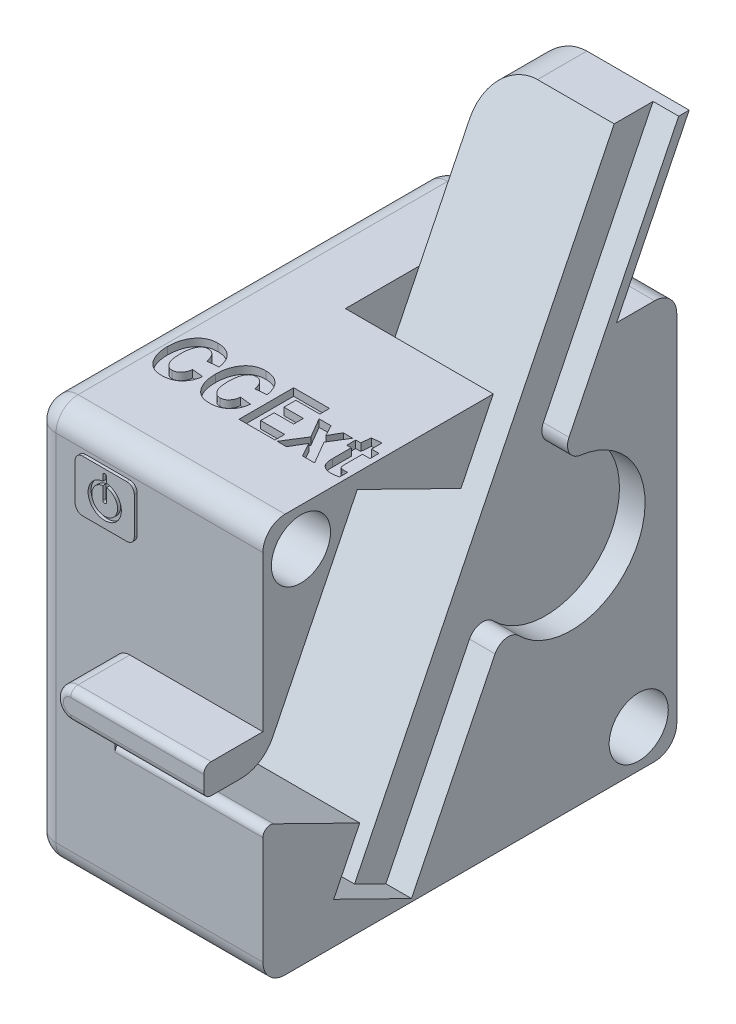
from build123d import *

# Parameters (mm, degrees)
SKETCH1_W           = 393.7
SKETCH1_H           = 342.9
BOSS_EXTRUDE1_DEPTH = 355.6
SKETCH2_W           = 50.8
SKETCH2_H           = 44.45
BOSS_EXTRUDE2_DEPTH = 2.54
BOSS_EXTRUDE3_DEPTH = 2.54
SKETCH4_R           = 3.81
CUT_EXTRUDE1_DEPTH  = 2.54
BOSS_EXTRUDE4_DEPTH = 50.8
FILLET1_R           = 6.35
FILLET2_R           = 6.35
SKETCH6_R           = 14.2875
SKETCH6_R_2         = 11.1125
CUT_EXTRUDE2_DEPTH  = 2.54
FILLET3_R           = 19.05
BOSS_EXTRUDE5_DEPTH = 127
FILLET4_R           = 39.116
SKETCH8_W           = 254
SKETCH8_H           = 63.5
CUT_EXTRUDE3_DEPTH  = 25.4
CUT_EXTRUDE4_DEPTH  = 652.703070808
CUT_EXTRUDE5_DEPTH  = 127
BOSS_EXTRUDE6_DEPTH = 127
SKETCH12_W          = 22
SKETCH12_H          = 524.644243645
CUT_EXTRUDE6_DEPTH  = 30
SKETCH13_R          = 63.5
CUT_EXTRUDE7_DEPTH  = 22
FILLET5_R           = 12.7
CUT_EXTRUDE8_REACH  = 653.703
FILLET7_R           = 6.35
SKETCH15_R          = 25.4
CUT_EXTRUDE9_DEPTH  = 53.34
CUT_EXTRUDE10_DEPTH = 6.35


with BuildPart() as part:
    # Sketch1 → Boss-Extrude1 (new body)
    with BuildSketch(Plane.XY):
        with Locations((0, 171.45)):
            Rectangle(SKETCH1_W, SKETCH1_H)
    extrude(amount=BOSS_EXTRUDE1_DEPTH)

    # Sketch2 → Boss-Extrude2 (add)
    with BuildSketch(Plane.XY.offset(355.6)):
        with Locations((-133.35, 298.45)):
            Rectangle(SKETCH2_W, SKETCH2_H)
    extrude(amount=BOSS_EXTRUDE2_DEPTH)

    # Sketch3 → Boss-Extrude3 (add)
    with BuildSketch(Plane.XY.offset(355.6)):
        with BuildLine():
            Line((88.9, 307.975), (165.1, 307.975))
            ThreePointArc((165.1, 307.975), (174.625, 298.45), (165.1, 288.925))
            Line((165.1, 288.925), (88.9, 288.925))
            ThreePointArc((88.9, 288.925), (79.375, 298.45), (88.9, 307.975))
        make_face()
    extrude(amount=BOSS_EXTRUDE3_DEPTH)

    # Sketch4 → Cut-Extrude1 (cut)
    with BuildSketch(Plane.XY.offset(358.14)):
        with Locations((92.075, 298.45)):
            Circle(SKETCH4_R)
        with Locations((108.286467636, 298.45)):
            Circle(SKETCH4_R)
        with Locations((124.497935272, 298.45)):
            Circle(SKETCH4_R)
    extrude(amount=-CUT_EXTRUDE1_DEPTH, mode=Mode.SUBTRACT)

    # Sketch5 → Boss-Extrude4 (add)
    with BuildSketch(Plane.XY.offset(355.6)):
        with BuildLine():
            Line((-114.3, 190.5), (114.3, 190.5))
            ThreePointArc((114.3, 190.5), (127, 177.8), (114.3, 165.1))
            Line((114.3, 165.1), (-114.3, 165.1))
            ThreePointArc((-114.3, 165.1), (-127, 177.8), (-114.3, 190.5))
        make_face()
    extrude(amount=BOSS_EXTRUDE4_DEPTH)

    # Fillet1
    fillet1_edges = [part.edges().sort_by_distance(p)[0] for p in [
        (-127, 177.8, 406.4),
        (0, 165.1, 406.4),
        (127, 177.8, 406.4),
        (0, 190.5, 406.4),
    ]]
    fillet(fillet1_edges, radius=FILLET1_R)

    # Fillet2
    fillet2_edges = [part.edges().sort_by_distance(p)[0] for p in [
        (-107.95, 276.225, 356.87),
        (-107.95, 320.675, 356.87),
        (-158.75, 320.675, 356.87),
        (-158.75, 276.225, 356.87),
    ]]
    fillet(fillet2_edges, radius=FILLET2_R)

    # Sketch6 → Cut-Extrude2 (cut)
    # profile 1 of 2: a face of its own
    with BuildSketch(Plane.XY.offset(358.14)):
        with Locations((-133.35, 296.545)):
            Circle(SKETCH6_R)
        with Locations((-133.35, 296.545)):
            Circle(SKETCH6_R_2, mode=Mode.SUBTRACT)
    # profile 2 of 2: a face of its own
    with BuildSketch(Plane.XY.offset(358.14)):
        with BuildLine():
            Line((-134.9375, 296.545), (-134.9375, 315.595))
            ThreePointArc((-134.9375, 315.595), (-133.35, 317.1825), (-131.7625, 315.595))
            Line((-131.7625, 315.595), (-131.7625, 296.545))
            ThreePointArc((-131.7625, 296.545), (-133.35, 294.9575), (-134.9375, 296.545))
        make_face()
    extrude(amount=-CUT_EXTRUDE2_DEPTH, mode=Mode.SUBTRACT)

    # Fillet3
    fillet3_edges = [part.edges().sort_by_distance(p)[0] for p in [
        (196.85, 171.45, 355.6),
        (0, 342.9, 355.6),
        (-196.85, 171.45, 355.6),
        (0, 342.9, 0),
        (196.85, 171.45, 0),
        (0, 0, 0),
        (-196.85, 171.45, 0),
        (0, 0, 355.6),
        (-196.85, 342.9, 177.8),
        (196.85, 342.9, 177.8),
        (196.85, 0, 177.8),
        (-196.85, 0, 177.8),
    ]]
    fillet(fillet3_edges, radius=FILLET3_R)

    # Sketch7 → Boss-Extrude5 (add, symmetric)
    with BuildSketch(Plane(origin=(0, 0, 0), x_dir=(0, 0, -1), z_dir=(1, 0, 0))):
        Polygon((-51.727584486, 342.9), (10.662740116, 469.9), (-31.786520589, 469.9), (-94.17684519, 342.9), align=None)
    extrude(amount=BOSS_EXTRUDE5_DEPTH, both=True)

    # Fillet4
    fillet4_edges = [part.edges().sort_by_distance(p)[0] for p in [
        (-127, 469.9, 10.561890237),
        (127, 469.9, 10.561890237),
    ]]
    fillet(fillet4_edges, radius=FILLET4_R)

    # Sketch8 → Cut-Extrude3 (cut)
    with BuildSketch(Plane(origin=(0, 342.9, 0), x_dir=(1, 0, 0), z_dir=(0, 1, 0))):
        with Locations((0, -125.92684519)):
            Rectangle(SKETCH8_W, SKETCH8_H)
    extrude(amount=-CUT_EXTRUDE3_DEPTH, mode=Mode.SUBTRACT)

    # Sketch9 → Cut-Extrude4 (cut, through all)
    with BuildSketch(Plane(origin=(0, 0, 0), x_dir=(0, 0, -1), z_dir=(1, 0, 0))):
        Polygon((-912.709368589, 769.44705767), (-210.006014515, -1175.153028305), (1122.715383104, 405.705970635), align=None)
    extrude(amount=CUT_EXTRUDE4_DEPTH, mode=Mode.SUBTRACT)

    # Sketch10 → Cut-Extrude5 (cut)
    with BuildSketch(Plane(origin=(0, 0, 0), x_dir=(0, 0, -1), z_dir=(1, 0, 0))):
        Polygon((-94.17684519, 342.9), (-254.864319987, 15.809069962), (-294.760067802, 35.408350722), (-272.360889792, 81.003491082), (-355.6, 121.895736006), (-355.6, 165.1), (-274.492578018, 330.2), (-185.41399178, 286.439040076), (-157.67684519, 342.9), align=None)
    extrude(amount=-CUT_EXTRUDE5_DEPTH, mode=Mode.SUBTRACT)

    # Sketch11 → Boss-Extrude6 (add)
    with BuildSketch(Plane(origin=(0, 0, 0), x_dir=(0, 0, -1), z_dir=(1, 0, 0))):
        Polygon((-94.17684519, 342.9), (-106.65491011, 317.5), (-94.17684519, 317.5), align=None)
    extrude(amount=-BOSS_EXTRUDE6_DEPTH)

    # Sketch12 → Cut-Extrude6 (cut)
    with BuildSketch(Plane(origin=(0, 103.936656142, 211.570550632), x_dir=(1, 0, 0), z_dir=(0, 0.4409287009906532, 0.8975421330738158))):
        with Locations((-11, 164.134434658)):
            Rectangle(SKETCH12_W, SKETCH12_H)
    extrude(amount=-CUT_EXTRUDE6_DEPTH, mode=Mode.SUBTRACT)

    # Sketch13 → Cut-Extrude7 (cut)
    with BuildSketch(Plane(origin=(0, 0, 0), x_dir=(0, 0, -1), z_dir=(1, 0, 0))):
        with Locations((-90.736174491, 196.869487567)):
            Circle(SKETCH13_R)
    extrude(amount=-CUT_EXTRUDE7_DEPTH, mode=Mode.SUBTRACT)

    # Fillet5
    fillet5_edges = [part.edges().sort_by_distance(p)[0] for p in [
        (-11, 259.403339367, 101.771000226),
        (-11, 167.385174117, 146.976064786),
    ]]
    fillet(fillet5_edges, radius=FILLET5_R)

    # Cut-Extrude8: up to this face of the body (flat: up to its plane)
    cut_extrude8_end = Plane(part.part.faces().sort_by_distance((-127, 200.182902159, 241.077544621))[0])
    # Sketch14 → Cut-Extrude8 (cut, up to the picked face)
    with BuildSketch(Plane(origin=(0, 0, 0), x_dir=(0, 0, -1), z_dir=(1, 0, 0)), mode=Mode.PRIVATE) as cut_extrude8_sk1:
        with BuildLine():
            Line((-374.585730659, 165.1), (-355.6, 165.1))
            Line((-355.6, 165.1), (-347.228646443, 182.140493194))
            ThreePointArc((-347.228646443, 182.140493194), (-358.470609925, 169.708523743), (-374.585730659, 165.1))
        make_face()
    cut_extrude8_tool1 = split(extrude(cut_extrude8_sk1.sketch, amount=-CUT_EXTRUDE8_REACH, mode=Mode.PRIVATE), bisect_by=cut_extrude8_end, keep=Keep.BOTH, mode=Mode.PRIVATE)
    add(cut_extrude8_tool1.solids().sort_by(Axis((0, 168.69856, 357.841512), (-1, 0, 0)))[0], mode=Mode.SUBTRACT)

    # Fillet7
    fillet7_edges = [part.edges().sort_by_distance(p)[0] for p in [
        (-63.5, 121.895736006, 355.6),
    ]]
    fillet(fillet7_edges, radius=FILLET7_R)

    # Sketch15 → Cut-Extrude9 (cut)
    with BuildSketch(Plane(origin=(0, 0, 0), x_dir=(0, 0, -1), z_dir=(1, 0, 0))):
        with Locations((-322.904380198, 310.204380198)):
            Circle(SKETCH15_R)
        with Locations((-32.695619802, 32.695619802)):
            Circle(SKETCH15_R)
    extrude(amount=-CUT_EXTRUDE9_DEPTH, mode=Mode.SUBTRACT)

    # Sketch16 → Cut-Extrude10 (cut)
    # profile 1 of 11: a face of its own
    with BuildSketch(Plane(origin=(0, 342.9, 0), x_dir=(1, 0, 0), z_dir=(0, 1, 0))):
        with BuildLine():
            Line((-147.362161067, -268.632482659), (-137.778762274, -269.606895325))
            add(Edge.make_bspline(
                [(-137.778762274, -269.606895325), (-137.852062752, -270.211350761), (-137.996412938, -271.401701162), (-138.389089932, -273.132629534), (-138.881356624, -274.788371564), (-139.530865829, -276.348400157), (-140.299011357, -277.82238181), (-141.180503635, -279.22063221), (-142.217374056, -280.514135585), (-143.353407648, -281.734782763), (-144.619894576, -282.823916044), (-145.982528791, -283.79101033), (-147.459738737, -284.598040268), (-149.042816753, -285.246348924), (-150.723651566, -285.763042697), (-152.505676939, -286.131497676), (-154.391528687, -286.357111451), (-155.682532133, -286.380797138), (-156.342830376, -286.392911449)],
                knots=[0, 0, 0, 0, 1.051982192, 2.07166211, 3.064163433, 4.034902158, 4.987714795, 5.935166584, 6.887152378, 7.84950099, 8.813936601, 9.76952359, 10.733246651, 11.716896322, 12.722162435, 13.768923523, 14.858890826, 16, 16, 16, 16], degree=3))
            add(Edge.make_bspline(
                [(-156.342830376, -286.392911449), (-156.872197624, -286.38338078), (-157.906382574, -286.364761429), (-159.418875521, -286.216264088), (-160.850324121, -285.948755718), (-162.215206012, -285.604993734), (-163.496801713, -285.139974539), (-164.708187841, -284.587080223), (-165.835658198, -283.918894492), (-166.893479955, -283.153686177), (-167.872065068, -282.296848068), (-168.796684913, -281.375275285), (-169.654568239, -280.381365539), (-170.46786309, -279.32312619), (-171.201908713, -278.183327187), (-171.907479374, -276.988957097), (-172.518016396, -275.707512602), (-173.098928541, -274.375664842), (-173.589468294, -272.981666146), (-174.039659003, -271.557906123), (-174.397732325, -270.089674676), (-174.695879928, -268.591052603), (-174.941859805, -267.057088316), (-175.109397852, -265.491289598), (-175.213827067, -263.889109935), (-175.223474776, -262.809609417), (-175.228354202, -262.263641114)],
                knots=[0, 0, 0, 0, 1.105609578, 2.159946219, 3.169608684, 4.145018578, 5.096309205, 6.013193973, 6.922417586, 7.828974177, 8.736285872, 9.636371327, 10.553549476, 11.476787637, 12.421499323, 13.383578628, 14.372015653, 15.3840493, 16.417202389, 17.456939369, 18.501862101, 19.571742627, 20.648005113, 21.745532771, 22.859780399, 24, 24, 24, 24], degree=3))
            add(Edge.make_bspline(
                [(-175.228354202, -262.263641114), (-175.213533189, -261.399169209), (-175.184520237, -259.706917805), (-174.939669559, -257.229076192), (-174.537344301, -254.873383878), (-173.993459736, -252.631317498), (-173.261806599, -250.51853845), (-172.396557015, -248.515971825), (-171.336314283, -246.652603751), (-170.155697767, -244.905797653), (-168.819767829, -243.328825186), (-167.361925692, -241.935993725), (-165.761853985, -240.776976361), (-164.04787386, -239.825073714), (-162.219569486, -239.071673431), (-160.262679874, -238.559622894), (-158.192826415, -238.22266292), (-156.769475206, -238.190832983), (-156.041465634, -238.174552743)],
                knots=[0, 0, 0, 0, 1.198178484, 2.345500427, 3.447453775, 4.509103708, 5.539599216, 6.543499879, 7.528638035, 8.507148543, 9.462269331, 10.388250012, 11.295364851, 12.193024101, 13.10070884, 14.028537591, 14.991644863, 16, 16, 16, 16], degree=3))
            add(Edge.make_bspline(
                [(-156.041465634, -238.174552743), (-155.431349396, -238.187120782), (-154.23746204, -238.211714164), (-152.490912393, -238.431848406), (-150.825379547, -238.767696691), (-149.242987467, -239.249471542), (-147.745926045, -239.876509664), (-146.331638876, -240.642899767), (-145.003095338, -241.553435244), (-143.753441111, -242.587168676), (-142.604321931, -243.757341537), (-141.566668099, -245.056176649), (-140.653229558, -246.486101901), (-139.835162489, -248.024524969), (-139.139232958, -249.692616474), (-138.577481644, -251.488257883), (-138.093720401, -253.397804163), (-137.8853572, -254.724074206), (-137.778762274, -255.402570489)],
                knots=[0, 0, 0, 0, 1.053980237, 2.062449089, 3.037335328, 3.987379173, 4.915943175, 5.837774954, 6.762291017, 7.69511876, 8.636291522, 9.591555379, 10.562673013, 11.564478635, 12.599430281, 13.681008754, 14.813645119, 16, 16, 16, 16], degree=3))
            Line((-137.778762274, -255.402570489), (-147.291842627, -256.326755698))
            add(Edge.make_bspline(
                [(-147.291842627, -256.326755698), (-147.382823986, -255.93098756), (-147.560263776, -255.159125985), (-147.864731317, -254.046075044), (-148.225850065, -253.014389917), (-148.595322049, -252.051804981), (-149.025090504, -251.173866277), (-149.474470065, -250.36446397), (-149.962613468, -249.63339676), (-150.49074142, -248.98090222), (-151.055291825, -248.40901319), (-151.647582692, -247.899258111), (-152.283226887, -247.477052703), (-152.954482877, -247.132160107), (-153.657478563, -246.859598523), (-154.398840553, -246.667287568), (-155.174250476, -246.557503564), (-155.702927417, -246.540850418), (-155.971147194, -246.532401586)],
                knots=[0, 0, 0, 0, 1.364641525, 2.661443042, 3.874868095, 5.036638674, 6.123695894, 7.156520859, 8.145828854, 9.073718286, 9.972847736, 10.84306696, 11.695053518, 12.530457183, 13.374680603, 14.223466012, 15.098690498, 16, 16, 16, 16], degree=3))
            add(Edge.make_bspline(
                [(-155.971147194, -246.532401586), (-156.270142717, -246.543536549), (-156.860367308, -246.565517242), (-157.723054755, -246.754337574), (-158.548452106, -247.055189995), (-159.321953755, -247.494313685), (-160.058606356, -248.047131152), (-160.746910657, -248.721781687), (-161.396446366, -249.516905108), (-161.996725914, -250.431652099), (-162.542026319, -251.473042739), (-163.009230301, -252.642574867), (-163.410232889, -253.936000542), (-163.741427725, -255.355584868), (-163.986277264, -256.907193133), (-164.164587511, -258.58695714), (-164.275337133, -260.39370977), (-164.290856137, -261.64065851), (-164.298859562, -262.283732096)],
                knots=[0, 0, 0, 0, 0.726895696, 1.434910162, 2.138785806, 2.857458904, 3.590857252, 4.374590525, 5.196778853, 6.085005742, 7.032695212, 8.052607015, 9.145406711, 10.325446451, 11.59680084, 12.965544286, 14.435077357, 16, 16, 16, 16], degree=3))
            add(Edge.make_bspline(
                [(-164.298859562, -262.283732096), (-164.291940102, -262.936913147), (-164.278549816, -264.200925044), (-164.153839951, -266.027500268), (-163.969641447, -267.721861799), (-163.700705477, -269.282781947), (-163.351626487, -270.713869016), (-162.925174876, -272.013892763), (-162.410598215, -273.176646696), (-161.829154498, -274.20723811), (-161.182993959, -275.105193381), (-160.495593339, -275.881203954), (-159.787942354, -276.5533314), (-159.03280371, -277.087728396), (-158.257271362, -277.524403283), (-157.432583893, -277.808887406), (-156.579530793, -278.002925866), (-155.995690787, -278.024256541), (-155.699918926, -278.035062607)],
                knots=[0, 0, 0, 0, 1.578182673, 3.054040949, 4.422086023, 5.695161059, 6.87854739, 7.978818638, 8.996746236, 9.946184514, 10.833196196, 11.664422499, 12.448801434, 13.185309597, 13.895016738, 14.591171581, 15.286291109, 16, 16, 16, 16], degree=3))
            add(Edge.make_bspline(
                [(-155.699918926, -278.035062607), (-155.43161591, -278.027338294), (-154.898969975, -278.012003678), (-154.116976547, -277.889926551), (-153.363403759, -277.685460412), (-152.640573051, -277.406782299), (-151.946898276, -277.03799653), (-151.28887525, -276.587138391), (-150.659989208, -276.05540103), (-150.059163893, -275.458999826), (-149.510955436, -274.786690792), (-149.016980394, -274.060687346), (-148.580646985, -273.281918126), (-148.215134178, -272.448896903), (-147.894444391, -271.568946303), (-147.666006979, -270.633700116), (-147.462239889, -269.653815011), (-147.396049371, -268.978322273), (-147.362161067, -268.632482659)],
                knots=[0, 0, 0, 0, 0.929161302, 1.844608371, 2.733809141, 3.629943943, 4.52246771, 5.449091207, 6.387761928, 7.372056715, 8.377585556, 9.387853863, 10.410894549, 11.465029895, 12.536385021, 13.650531068, 14.797115969, 16, 16, 16, 16], degree=3))
        make_face()
    # profile 2 of 11: a face of its own
    with BuildSketch(Plane(origin=(0, 342.9, 0), x_dir=(1, 0, 0), z_dir=(0, 1, 0))):
        with BuildLine():
            Line((-106.215828304, -268.632482659), (-96.632429511, -269.606895325))
            add(Edge.make_bspline(
                [(-96.632429511, -269.606895325), (-96.70572999, -270.211350761), (-96.850080175, -271.401701162), (-97.24275717, -273.132629534), (-97.735023862, -274.788371564), (-98.384533066, -276.348400157), (-99.152678595, -277.82238181), (-100.034170872, -279.22063221), (-101.071041294, -280.514135585), (-102.207074885, -281.734782763), (-103.473561814, -282.823916044), (-104.836196028, -283.79101033), (-106.313405975, -284.598040268), (-107.896483991, -285.246348924), (-109.577318803, -285.763042697), (-111.359344176, -286.131497676), (-113.245195924, -286.357111451), (-114.536199371, -286.380797138), (-115.196497613, -286.392911449)],
                knots=[0, 0, 0, 0, 1.051982192, 2.07166211, 3.064163433, 4.034902158, 4.987714795, 5.935166584, 6.887152378, 7.84950099, 8.813936601, 9.76952359, 10.733246651, 11.716896322, 12.722162435, 13.768923523, 14.858890826, 16, 16, 16, 16], degree=3))
            add(Edge.make_bspline(
                [(-115.196497613, -286.392911449), (-115.725864861, -286.38338078), (-116.760049812, -286.364761429), (-118.272542758, -286.216264088), (-119.703991358, -285.948755718), (-121.068873249, -285.604993734), (-122.35046895, -285.139974539), (-123.561855078, -284.587080223), (-124.689325435, -283.918894492), (-125.747147192, -283.153686177), (-126.725732305, -282.296848068), (-127.650352151, -281.375275285), (-128.508235477, -280.381365539), (-129.321530327, -279.32312619), (-130.05557595, -278.183327187), (-130.761146611, -276.988957097), (-131.371683634, -275.707512602), (-131.952595778, -274.375664842), (-132.443135531, -272.981666146), (-132.89332624, -271.557906123), (-133.251399562, -270.089674676), (-133.549547166, -268.591052603), (-133.795527043, -267.057088316), (-133.96306509, -265.491289598), (-134.067494305, -263.889109935), (-134.077142013, -262.809609417), (-134.08202144, -262.263641114)],
                knots=[0, 0, 0, 0, 1.105609578, 2.159946219, 3.169608684, 4.145018578, 5.096309205, 6.013193973, 6.922417586, 7.828974177, 8.736285872, 9.636371327, 10.553549476, 11.476787637, 12.421499323, 13.383578628, 14.372015653, 15.3840493, 16.417202389, 17.456939369, 18.501862101, 19.571742627, 20.648005113, 21.745532771, 22.859780399, 24, 24, 24, 24], degree=3))
            add(Edge.make_bspline(
                [(-134.08202144, -262.263641114), (-134.067200426, -261.399169209), (-134.038187474, -259.706917805), (-133.793336796, -257.229076192), (-133.391011539, -254.873383878), (-132.847126974, -252.631317498), (-132.115473837, -250.51853845), (-131.250224252, -248.515971825), (-130.189981521, -246.652603751), (-129.009365005, -244.905797653), (-127.673435067, -243.328825186), (-126.21559293, -241.935993725), (-124.615521223, -240.776976361), (-122.901541098, -239.825073714), (-121.073236723, -239.071673431), (-119.116347111, -238.559622894), (-117.046493652, -238.22266292), (-115.623142443, -238.190832983), (-114.895132871, -238.174552743)],
                knots=[0, 0, 0, 0, 1.198178484, 2.345500427, 3.447453775, 4.509103708, 5.539599216, 6.543499879, 7.528638035, 8.507148543, 9.462269331, 10.388250012, 11.295364851, 12.193024101, 13.10070884, 14.028537591, 14.991644863, 16, 16, 16, 16], degree=3))
            add(Edge.make_bspline(
                [(-114.895132871, -238.174552743), (-114.285016634, -238.187120782), (-113.091129278, -238.211714164), (-111.34457963, -238.431848406), (-109.679046785, -238.767696691), (-108.096654705, -239.249471542), (-106.599593283, -239.876509664), (-105.185306113, -240.642899767), (-103.856762575, -241.553435244), (-102.607108348, -242.587168676), (-101.457989168, -243.757341537), (-100.420335336, -245.056176649), (-99.506896796, -246.486101901), (-98.688829727, -248.024524969), (-97.992900196, -249.692616474), (-97.431148881, -251.488257883), (-96.947387638, -253.397804163), (-96.739024437, -254.724074206), (-96.632429511, -255.402570489)],
                knots=[0, 0, 0, 0, 1.053980237, 2.062449089, 3.037335328, 3.987379173, 4.915943175, 5.837774954, 6.762291017, 7.69511876, 8.636291522, 9.591555379, 10.562673013, 11.564478635, 12.599430281, 13.681008754, 14.813645119, 16, 16, 16, 16], degree=3))
            Line((-96.632429511, -255.402570489), (-106.145509864, -256.326755698))
            add(Edge.make_bspline(
                [(-106.145509864, -256.326755698), (-106.236491224, -255.93098756), (-106.413931014, -255.159125985), (-106.718398555, -254.046075044), (-107.079517302, -253.014389917), (-107.448989287, -252.051804981), (-107.878757742, -251.173866277), (-108.328137302, -250.36446397), (-108.816280706, -249.63339676), (-109.344408658, -248.98090222), (-109.908959063, -248.40901319), (-110.50124993, -247.899258111), (-111.136894125, -247.477052703), (-111.808150115, -247.132160107), (-112.511145801, -246.859598523), (-113.252507791, -246.667287568), (-114.027917714, -246.557503564), (-114.556594655, -246.540850418), (-114.824814432, -246.532401586)],
                knots=[0, 0, 0, 0, 1.364641525, 2.661443042, 3.874868095, 5.036638674, 6.123695894, 7.156520859, 8.145828854, 9.073718286, 9.972847736, 10.84306696, 11.695053518, 12.530457183, 13.374680603, 14.223466012, 15.098690498, 16, 16, 16, 16], degree=3))
            add(Edge.make_bspline(
                [(-114.824814432, -246.532401586), (-115.123809955, -246.543536549), (-115.714034546, -246.565517242), (-116.576721992, -246.754337574), (-117.402119344, -247.055189995), (-118.175620993, -247.494313685), (-118.912273593, -248.047131152), (-119.600577895, -248.721781687), (-120.250113604, -249.516905108), (-120.850393151, -250.431652099), (-121.395693557, -251.473042739), (-121.862897538, -252.642574867), (-122.263900126, -253.936000542), (-122.595094962, -255.355584868), (-122.839944501, -256.907193133), (-123.018254748, -258.58695714), (-123.12900437, -260.39370977), (-123.144523374, -261.64065851), (-123.1525268, -262.283732096)],
                knots=[0, 0, 0, 0, 0.726895696, 1.434910162, 2.138785806, 2.857458904, 3.590857252, 4.374590525, 5.196778853, 6.085005742, 7.032695212, 8.052607015, 9.145406711, 10.325446451, 11.59680084, 12.965544286, 14.435077357, 16, 16, 16, 16], degree=3))
            add(Edge.make_bspline(
                [(-123.1525268, -262.283732096), (-123.145607339, -262.936913147), (-123.132217054, -264.200925044), (-123.007507188, -266.027500268), (-122.823308684, -267.721861799), (-122.554372714, -269.282781947), (-122.205293724, -270.713869016), (-121.778842114, -272.013892763), (-121.264265452, -273.176646696), (-120.682821736, -274.20723811), (-120.036661197, -275.105193381), (-119.349260576, -275.881203954), (-118.641609591, -276.5533314), (-117.886470947, -277.087728396), (-117.110938599, -277.524403283), (-116.28625113, -277.808887406), (-115.433198031, -278.002925866), (-114.849358025, -278.024256541), (-114.553586164, -278.035062607)],
                knots=[0, 0, 0, 0, 1.578182673, 3.054040949, 4.422086023, 5.695161059, 6.87854739, 7.978818638, 8.996746236, 9.946184514, 10.833196196, 11.664422499, 12.448801434, 13.185309597, 13.895016738, 14.591171581, 15.286291109, 16, 16, 16, 16], degree=3))
            add(Edge.make_bspline(
                [(-114.553586164, -278.035062607), (-114.285283147, -278.027338294), (-113.752637213, -278.012003678), (-112.970643785, -277.889926551), (-112.217070997, -277.685460412), (-111.494240289, -277.406782299), (-110.800565514, -277.03799653), (-110.142542488, -276.587138391), (-109.513656445, -276.05540103), (-108.912831131, -275.458999826), (-108.364622673, -274.786690792), (-107.870647632, -274.060687346), (-107.434314223, -273.281918126), (-107.068801415, -272.448896903), (-106.748111628, -271.568946303), (-106.519674217, -270.633700116), (-106.315907127, -269.653815011), (-106.249716608, -268.978322273), (-106.215828304, -268.632482659)],
                knots=[0, 0, 0, 0, 0.929161302, 1.844608371, 2.733809141, 3.629943943, 4.52246771, 5.449091207, 6.387761928, 7.372056715, 8.377585556, 9.387853863, 10.410894549, 11.465029895, 12.536385021, 13.650531068, 14.797115969, 16, 16, 16, 16], degree=3))
        make_face()
    # profile 3 of 11: a face of its own
    with BuildSketch(Plane(origin=(0, 342.9, 0), x_dir=(1, 0, 0), z_dir=(0, 1, 0))):
        Polygon((-59.504293308, -285.75), (-90.36404288, -285.75), (-90.36404288, -238.817464193), (-59.504293308, -238.817464193), (-59.504293308, -247.175313035), (-80.077459689, -247.175313035), (-80.077459689, -257.461896226), (-63.361762004, -257.461896226), (-63.361762004, -265.819745068), (-80.077459689, -265.819745068), (-80.077459689, -277.392151158), (-59.504293308, -277.392151158), align=None)
    # profile 4 of 11: a face of its own
    with BuildSketch(Plane(origin=(0, 342.9, 0), x_dir=(1, 0, 0), z_dir=(0, 1, 0))):
        Polygon((-25.429986489, -285.75), (-35.79693361, -285.75), (-42.416912441, -273.665273849), (-49.539165842, -285.75), (-57.575558959, -285.75), (-46.425063509, -267.98957121), (-56.289736061, -251.032781732), (-46.023243853, -251.032781732), (-40.960316189, -260.565953067), (-35.515659851, -251.032781732), (-27.358720837, -251.032781732), (-36.841664716, -266.241655707), align=None)
    # profile 5 of 11: a face of its own
    with BuildSketch(Plane(origin=(0, 342.9, 0), x_dir=(1, 0, 0), z_dir=(0, 1, 0))):
        with BuildLine():
            Line((-4.213908658, -278.607655617), (-4.213908658, -285.539044681))
            add(Edge.make_bspline(
                [(-4.213908658, -285.539044681), (-4.578643773, -285.607442926), (-5.280470896, -285.739055545), (-6.296360806, -285.905935943), (-7.232691143, -286.06155365), (-8.090265603, -286.18140783), (-8.871098941, -286.270933417), (-9.573783202, -286.344643157), (-10.200466777, -286.387474138), (-10.592743243, -286.391195568), (-10.77361454, -286.392911449)],
                knots=[0, 0, 0, 0, 1.344725773, 2.587535395, 3.730615261, 4.784280217, 5.724986617, 6.578628254, 7.344632233, 8, 8, 8, 8], degree=3))
            add(Edge.make_bspline(
                [(-10.77361454, -286.392911449), (-11.296811167, -286.377341087), (-12.315054353, -286.347038109), (-13.786964348, -286.116841782), (-15.149009711, -285.725304234), (-16.387215131, -285.174545047), (-17.489044316, -284.478757987), (-18.442673876, -283.661415501), (-19.240930244, -282.725228261), (-19.766207893, -281.838869989), (-20.110041754, -281.059544957), (-20.334438484, -280.397854624), (-20.504012031, -279.665292789), (-20.672180586, -278.870245837), (-20.789189159, -278.004082043), (-20.865764768, -277.06847022), (-20.917001115, -276.06334981), (-20.9253124, -275.369724384), (-20.929606343, -275.011369696)],
                knots=[0, 0, 0, 0, 1.428737937, 2.780604069, 4.057097827, 5.289475521, 6.469416875, 7.604364234, 8.707577078, 9.815028407, 10.404750877, 11.032407345, 11.720104387, 12.457353225, 13.251577828, 14.105349067, 15.021147411, 16, 16, 16, 16], degree=3))
            Line((-20.929606343, -275.011369696), (-20.929606343, -258.747719125))
            Line((-20.929606343, -258.747719125), (-24.787075039, -258.747719125))
            Line((-24.787075039, -258.747719125), (-24.787075039, -251.032781732))
            Line((-24.787075039, -251.032781732), (-20.447422756, -251.032781732))
            Line((-20.447422756, -251.032781732), (-19.754283849, -242.735205838))
            Line((-19.754283849, -242.735205838), (-11.285934602, -242.03202144))
            Line((-11.285934602, -242.03202144), (-11.285934602, -251.032781732))
            Line((-11.285934602, -251.032781732), (-4.856820107, -251.032781732))
            Line((-4.856820107, -251.032781732), (-4.856820107, -258.747719125))
            Line((-4.856820107, -258.747719125), (-11.285934602, -258.747719125))
            Line((-11.285934602, -258.747719125), (-11.285934602, -274.02691154))
            add(Edge.make_bspline(
                [(-11.285934602, -274.02691154), (-11.285450934, -274.268111336), (-11.284536542, -274.724108576), (-11.239355243, -275.373769626), (-11.186957481, -275.95535018), (-11.091479837, -276.47050659), (-10.991730653, -276.921690141), (-10.844754014, -277.299326742), (-10.691026929, -277.617049665), (-10.426809955, -277.953535242), (-9.951379351, -278.258406063), (-9.240347638, -278.517677645), (-8.337390647, -278.65358265), (-7.676591332, -278.669393349), (-7.3179655, -278.677974056)],
                knots=[0, 0, 0, 0, 1.184079484, 2.238546571, 3.19738611, 4.048986522, 4.810752083, 5.461276567, 6.034932864, 6.538290048, 7.541910758, 8.754423028, 10.238576044, 12, 12, 12, 12], degree=3))
            add(Edge.make_bspline(
                [(-7.3179655, -278.677974056), (-7.150541577, -278.678326481), (-6.752048377, -278.679165303), (-6.065383531, -278.670290155), (-5.198518156, -278.632927462), (-4.562186314, -278.616594815), (-4.213908658, -278.607655617)],
                knots=[0, 0, 0, 0, 0.647033898, 1.540034446, 2.653609674, 4, 4, 4, 4], degree=3))
        make_face()
    # profile 6 of 11: a face of its own
    with BuildSketch(Plane(origin=(0, 342.9, 0), x_dir=(1, 0, 0), z_dir=(0, 1, 0))):
        with BuildLine():
            Line((11.215966128, -285.75), (1.572294387, -285.75))
            Line((1.572294387, -285.75), (1.572294387, -251.032781732))
            Line((1.572294387, -251.032781732), (10.482645256, -251.032781732))
            Line((10.482645256, -251.032781732), (10.482645256, -259.380585083))
            add(Edge.make_bspline(
                [(10.482645256, -259.380585083), (10.456995029, -259.025667439), (10.407129881, -258.335692224), (10.4818144, -257.327478751), (10.605999929, -256.37669026), (10.866417995, -255.49953437), (11.201243216, -254.68086799), (11.666913336, -253.949480851), (12.199052175, -253.258990541), (13.050016985, -252.473496754), (14.180441233, -251.640677211), (15.612617833, -250.901788913), (17.081178302, -250.440974388), (18.077276884, -250.386593429), (18.569265831, -250.359733808)],
                knots=[0, 0, 0, 0, 0.933135414, 1.814055513, 2.649751193, 3.445734889, 4.210102309, 4.964183321, 5.715387719, 6.492844488, 7.996616527, 9.388779399, 10.710276577, 12, 12, 12, 12], degree=3))
            add(Edge.make_bspline(
                [(18.569265831, -250.359733808), (18.666378093, -250.362929661), (18.920928055, -250.371306607), (19.399705487, -250.392990693), (20.066092384, -250.422280689), (20.575024533, -250.446592612), (20.859637869, -250.460188722)],
                knots=[0, 0, 0, 0, 0.508581428, 1.333089968, 2.508567079, 4, 4, 4, 4], degree=3))
            Line((20.859637869, -250.460188722), (20.859637869, -259.390630574))
            add(Edge.make_bspline(
                [(20.859637869, -259.390630574), (20.366867436, -259.39821113), (19.425302054, -259.412695745), (18.080899249, -259.5777009), (16.873480024, -259.8296066), (15.80146864, -260.191670449), (14.865519995, -260.657678343), (14.080124364, -261.253575143), (13.42101899, -261.940092293), (12.768703827, -263.000584182), (12.174170154, -264.404430896), (11.615956891, -266.106548342), (11.28285014, -267.832668293), (11.238233488, -268.9894064), (11.215966128, -269.566713359)],
                knots=[0, 0, 0, 0, 1.098123909, 2.098249789, 3.014947188, 3.84366355, 4.614968625, 5.334684203, 6.031858195, 6.723574143, 8.097160144, 9.421744439, 10.713239523, 12, 12, 12, 12], degree=3))
            Line((11.215966128, -269.566713359), (11.215966128, -285.75))
        make_face()
    # profile 7 of 11: a face of its own
    with BuildSketch(Plane(origin=(0, 342.9, 0), x_dir=(1, 0, 0), z_dir=(0, 1, 0))):
        with BuildLine():
            Line((55.938493828, -285.75), (46.616277811, -285.75))
            add(Edge.make_bspline(
                [(46.616277811, -285.75), (46.447670441, -285.166030689), (46.116883926, -284.020356141), (45.763788018, -282.299112224), (45.553898637, -280.615392361), (45.532067398, -279.505620527), (45.521319249, -278.959247816)],
                knots=[0, 0, 0, 0, 1.056075856, 2.071888377, 3.050734987, 4, 4, 4, 4], degree=3))
            add(Edge.make_bspline(
                [(45.521319249, -278.959247816), (45.452008046, -279.261695918), (45.317401972, -279.849066356), (45.046551659, -280.696145757), (44.697940205, -281.476777144), (44.317089943, -282.217966662), (43.842033681, -282.879510498), (43.33385574, -283.503230785), (42.746234476, -284.050632215), (42.110675504, -284.550072052), (41.40991486, -284.980645003), (40.655919983, -285.365133006), (39.837894584, -285.685673001), (38.960632605, -285.946111439), (38.023449409, -286.146845996), (37.025846218, -286.281973186), (35.969891703, -286.377590378), (35.245010227, -286.387716225), (34.873098368, -286.392911449)],
                knots=[0, 0, 0, 0, 1.042256254, 2.024117547, 2.981309279, 3.912363431, 4.817364119, 5.711815834, 6.610994718, 7.50883559, 8.42343388, 9.369254213, 10.348986562, 11.370455079, 12.440568841, 13.565340854, 14.750859775, 16, 16, 16, 16], degree=3))
            add(Edge.make_bspline(
                [(34.873098368, -286.392911449), (34.454224892, -286.382454777), (33.634154542, -286.361982707), (32.431847731, -286.225402203), (31.293875134, -285.969234176), (30.216467175, -285.630680837), (29.201349862, -285.196771302), (28.252190514, -284.660446837), (27.363173063, -284.027423656), (26.556200027, -283.291707428), (25.819048966, -282.493186008), (25.190598111, -281.62361174), (24.639485138, -280.717509423), (24.196924929, -279.756660134), (23.850775286, -278.743787139), (23.617680435, -277.678252756), (23.457748356, -276.566512891), (23.44021098, -275.808895952), (23.431283667, -275.423234844)],
                knots=[0, 0, 0, 0, 1.129603289, 2.211536937, 3.256555307, 4.270327097, 5.253227758, 6.227630559, 7.204874191, 8.189473903, 9.167384766, 10.1300017, 11.077723217, 12.023075911, 12.976800611, 13.958165456, 14.96061435, 16, 16, 16, 16], degree=3))
            add(Edge.make_bspline(
                [(23.431283667, -275.423234844), (23.445594233, -274.929874309), (23.473520713, -273.967101553), (23.723398124, -272.574848581), (24.108976377, -271.269160147), (24.680514531, -270.069859332), (25.395962722, -268.955247287), (26.299873231, -267.961124469), (27.333561054, -267.036041171), (28.548249855, -266.233996952), (29.910229517, -265.523620154), (31.427939323, -264.895514001), (33.109310484, -264.384694113), (34.946822454, -263.948090617), (36.945413961, -263.627460252), (39.10058141, -263.38484202), (41.414280194, -263.247532348), (43.009770862, -263.228032467), (43.833676694, -263.217962796)],
                knots=[0, 0, 0, 0, 0.88343129, 1.723979763, 2.526951805, 3.316172845, 4.096791826, 4.891650555, 5.71641369, 6.576882987, 7.492205456, 8.46619461, 9.515795754, 10.63802015, 11.848498724, 13.140732759, 14.523484342, 16, 16, 16, 16], degree=3))
            add(Edge.make_bspline(
                [(43.833676694, -263.217962796), (44.084834699, -263.220322334), (44.570481659, -263.224884811), (45.055896209, -263.240540233), (45.290272947, -263.24809927)],
                knots=[0, 0, 0, 0, 1.03432339, 2, 2, 2, 2], degree=3))
            Line((45.290272947, -263.24809927), (45.290272947, -261.791503018))
            add(Edge.make_bspline(
                [(45.290272947, -261.791503018), (45.272101967, -261.500786684), (45.237054525, -260.940064922), (44.933414406, -260.15857251), (44.431538346, -259.501656319), (43.725832388, -258.980172653), (42.830402471, -258.583757283), (41.74880384, -258.301321712), (40.476813091, -258.135828085), (39.568226526, -258.115618964), (39.082159264, -258.104807675)],
                knots=[0, 0, 0, 0, 0.856919689, 1.652791609, 2.436695782, 3.270086098, 4.217819787, 5.315058883, 6.563634959, 8, 8, 8, 8], degree=3))
            add(Edge.make_bspline(
                [(39.082159264, -258.104807675), (38.642794485, -258.114926747), (37.810130107, -258.134103956), (36.632196813, -258.314896711), (35.594403524, -258.610820784), (34.695021783, -259.033892624), (33.933870553, -259.579659665), (33.329393842, -260.261061055), (32.863049177, -261.060126483), (32.68451536, -261.656048632), (32.592771821, -261.962276372)],
                knots=[0, 0, 0, 0, 1.28294207, 2.431374135, 3.471526056, 4.425475343, 5.321692882, 6.187768125, 7.068744681, 8, 8, 8, 8], degree=3))
            Line((32.592771821, -261.962276372), (24.445878298, -260.545862085))
            add(Edge.make_bspline(
                [(24.445878298, -260.545862085), (24.505097345, -260.155898581), (24.621677055, -259.388209232), (24.926928828, -258.2808708), (25.329266496, -257.235067233), (25.842384646, -256.255475228), (26.47100491, -255.349043208), (27.197984345, -254.50583099), (28.041902573, -253.744508253), (28.976227974, -253.033756505), (30.027522281, -252.414655017), (31.180271122, -251.868787179), (32.439372189, -251.411253177), (33.801558525, -251.027136855), (35.269909713, -250.738607685), (36.841526257, -250.547382373), (38.513762789, -250.407201826), (39.664477791, -250.395764394), (40.257481757, -250.389870282)],
                knots=[0, 0, 0, 0, 0.909731506, 1.79091423, 2.64486797, 3.491833629, 4.336468865, 5.185653052, 6.055407974, 6.95500481, 7.890757929, 8.865650325, 9.895048386, 10.978938957, 12.129341351, 13.344852745, 14.631709111, 16, 16, 16, 16], degree=3))
            add(Edge.make_bspline(
                [(40.257481757, -250.389870282), (40.907247795, -250.400911803), (42.157919702, -250.422164559), (43.950610031, -250.543622747), (45.581370454, -250.776379364), (47.058822253, -251.091413844), (48.40629915, -251.517079894), (49.63849515, -252.050595855), (50.746487038, -252.737283238), (51.731645396, -253.526229938), (52.590263682, -254.379884974), (53.29875216, -255.27350137), (53.878329713, -256.178042685), (54.216865693, -256.986296429), (54.436681147, -257.669529338), (54.55741353, -258.257177283), (54.686713549, -258.911427993), (54.765902666, -259.647891068), (54.853170882, -260.453855482), (54.897473239, -261.335719598), (54.929109072, -262.290181366), (54.932290211, -262.953395889), (54.933944688, -263.298326727)],
                knots=[0, 0, 0, 0, 1.707853497, 3.287282293, 4.718538976, 6.033903952, 7.25294841, 8.427074371, 9.5530501, 10.667688358, 11.738019443, 12.727590382, 13.660437673, 14.551371475, 15.021763348, 15.544853457, 16.126548967, 16.773845561, 17.490149981, 18.257052185, 19.093511328, 20, 20, 20, 20], degree=3))
            Line((54.933944688, -263.298326727), (54.933944688, -278.366563823))
            add(Edge.make_bspline(
                [(54.933944688, -278.366563823), (54.94530694, -278.936344651), (54.968692695, -280.10906603), (55.176105157, -281.90948437), (55.481429099, -283.805975683), (55.78299796, -285.08863252), (55.938493828, -285.75)],
                knots=[0, 0, 0, 0, 0.91518711, 1.883635665, 2.908753684, 4, 4, 4, 4], degree=3))
        make_face()
        with BuildLine():
            add(Edge.make_bspline(
                [(45.290272947, -269.034302315), (44.797945468, -269.036988859), (43.842881619, -269.042200474), (42.459195513, -269.115432013), (41.169181243, -269.224695994), (39.974609075, -269.370050681), (38.874099356, -269.570208865), (37.870892526, -269.819365966), (36.961591808, -270.111666091), (36.142909066, -270.436025377), (35.42556268, -270.822325406), (34.797370977, -271.240234535), (34.26546029, -271.708575376), (33.825273195, -272.222498616), (33.493677479, -272.793589066), (33.247150745, -273.401152396), (33.104304715, -274.057224379), (33.084914501, -274.508407354), (33.074955408, -274.740141429)],
                knots=[0, 0, 0, 0, 1.583569298, 3.071958919, 4.455803479, 5.747764986, 6.941468335, 8.051777733, 9.070304845, 10.012433611, 10.879863808, 11.686510856, 12.43434117, 13.152895402, 13.85304832, 14.54912934, 15.25481193, 16, 16, 16, 16], degree=3))
            add(Edge.make_bspline(
                [(33.074955408, -274.740141429), (33.086985234, -275.029651911), (33.110142535, -275.586956896), (33.327988342, -276.371497168), (33.67021504, -277.068618283), (34.177591184, -277.651380232), (34.821946235, -278.11990281), (35.603837211, -278.453491389), (36.51873967, -278.638700709), (37.16929904, -278.664344648), (37.515062606, -278.677974056)],
                knots=[0, 0, 0, 0, 1.027958443, 1.97881044, 2.873917907, 3.769421702, 4.698759279, 5.685864565, 6.770068103, 8, 8, 8, 8], degree=3))
            add(Edge.make_bspline(
                [(37.515062606, -278.677974056), (37.83014472, -278.673544828), (38.438616086, -278.664991314), (39.32236183, -278.560686241), (40.144995683, -278.396488047), (40.905702043, -278.148011047), (41.612341809, -277.854858171), (42.253051669, -277.473823123), (42.836664644, -277.03616149), (43.516445757, -276.360476537), (44.229949668, -275.413025924), (44.850138743, -274.14167695), (45.2257897, -272.755568901), (45.268441997, -271.795817829), (45.290272947, -271.304583371)],
                knots=[0, 0, 0, 0, 0.937157597, 1.809793507, 2.644272928, 3.428956531, 4.187844571, 4.915880808, 5.641321056, 6.353011891, 7.762020205, 9.148007673, 10.540249709, 12, 12, 12, 12], degree=3))
            Line((45.290272947, -271.304583371), (45.290272947, -269.034302315))
        make_face(mode=Mode.SUBTRACT)
    # profile 8 of 11: a face of its own
    with BuildSketch(Plane(origin=(0, 342.9, 0), x_dir=(1, 0, 0), z_dir=(0, 1, 0))):
        with BuildLine():
            Line((82.900592738, -272.248859562), (91.097713718, -273.0223624))
            add(Edge.make_bspline(
                [(91.097713718, -273.0223624), (90.986063187, -273.580397549), (90.768953197, -274.665524547), (90.304432442, -276.214346257), (89.795307358, -277.659551807), (89.170135066, -278.978699244), (88.49801843, -280.203832436), (87.715645012, -281.302272108), (86.864140619, -282.29491996), (85.918995574, -283.160488553), (84.917422145, -283.925156707), (83.850466874, -284.580232484), (82.73858397, -285.14773484), (81.557843874, -285.598567996), (80.326713733, -285.963761179), (79.03097534, -286.210409682), (77.684082848, -286.365300966), (76.766579232, -286.383613184), (76.30070489, -286.392911449)],
                knots=[0, 0, 0, 0, 1.243269833, 2.417599794, 3.531332748, 4.589035123, 5.604960809, 6.581769228, 7.531294633, 8.458438852, 9.377778273, 10.28166156, 11.191658721, 12.102362082, 13.040421014, 13.995010892, 14.981940817, 16, 16, 16, 16], degree=3))
            add(Edge.make_bspline(
                [(76.30070489, -286.392911449), (75.716944728, -286.379690787), (74.577205077, -286.353878622), (72.923051875, -286.088247958), (71.361675195, -285.701712295), (69.919855136, -285.107435126), (68.573603503, -284.369065956), (67.334920582, -283.460350161), (66.201221632, -282.386993639), (65.193372521, -281.156291571), (64.297706947, -279.815568824), (63.510707129, -278.394355055), (62.843536524, -276.899331376), (62.30463787, -275.331708037), (61.880173884, -273.696213634), (61.580875406, -271.989906176), (61.396614906, -270.213695991), (61.37435102, -269.004614842), (61.363059182, -268.391390866)],
                knots=[0, 0, 0, 0, 1.064107676, 2.077575331, 3.049595623, 3.992320231, 4.913824011, 5.844916975, 6.786988143, 7.754563593, 8.740687892, 9.725088677, 10.715065776, 11.723568273, 12.745963555, 13.794543458, 14.881432541, 16, 16, 16, 16], degree=3))
            add(Edge.make_bspline(
                [(61.363059182, -268.391390866), (61.378022082, -267.75811832), (61.407383393, -266.51546399), (61.594726642, -264.693302086), (61.930720109, -262.954178664), (62.387914535, -261.295314383), (62.985747669, -259.71970258), (63.70485495, -258.223629006), (64.58328283, -256.825340582), (65.55554361, -255.49863278), (66.651477288, -254.30049537), (67.849209906, -253.254625433), (69.130398562, -252.36394715), (70.504263435, -251.632947946), (71.975974817, -251.082859389), (73.527423494, -250.68069535), (75.167703441, -250.433293662), (76.289785111, -250.404556905), (76.863252408, -250.389870282)],
                knots=[0, 0, 0, 0, 1.140307988, 2.237596855, 3.293540701, 4.326302469, 5.331885281, 6.324203961, 7.309703764, 8.30092284, 9.282412284, 10.226773246, 11.15834475, 12.086142993, 13.021161564, 13.980474365, 14.967872002, 16, 16, 16, 16], degree=3))
            add(Edge.make_bspline(
                [(76.863252408, -250.389870282), (77.35263651, -250.397996497), (78.307414984, -250.413850579), (79.701157111, -250.581627632), (81.019013436, -250.838635152), (82.265317252, -251.19984411), (83.430020793, -251.670866047), (84.518966651, -252.2482491), (85.524821172, -252.93737572), (86.464559473, -253.717441709), (87.312786093, -254.619061286), (88.103103192, -255.608741699), (88.787075777, -256.724147482), (89.418796133, -257.924612016), (89.959513461, -259.237128066), (90.414826191, -260.656919511), (90.813038952, -262.174842695), (91.001252821, -263.2297947), (91.097713718, -263.770464823)],
                knots=[0, 0, 0, 0, 1.084048201, 2.114956093, 3.106021041, 4.057050346, 4.985816562, 5.885459824, 6.782835512, 7.683549287, 8.586308788, 9.521574083, 10.485143205, 11.480864449, 12.52546249, 13.626045837, 14.783332244, 16, 16, 16, 16], degree=3))
            Line((91.097713718, -263.770464823), (82.820228807, -264.533922169))
            add(Edge.make_bspline(
                [(82.820228807, -264.533922169), (82.738011197, -264.029294856), (82.582507435, -263.074858871), (82.184967628, -261.752554567), (81.651516564, -260.634988803), (81.007310955, -259.701301666), (80.21817889, -258.983600984), (79.307794217, -258.464566612), (78.268955863, -258.156555501), (77.535067163, -258.12247646), (77.154571659, -258.104807675)],
                knots=[0, 0, 0, 0, 1.291472438, 2.442649722, 3.476078625, 4.410763155, 5.291508839, 6.148134602, 7.039872858, 8, 8, 8, 8], degree=3))
            add(Edge.make_bspline(
                [(77.154571659, -258.104807675), (76.916099579, -258.114931846), (76.445017454, -258.134931319), (75.761830712, -258.278907737), (75.117314345, -258.506867127), (74.52866682, -258.852168441), (73.969199862, -259.271236557), (73.468222598, -259.804935899), (73.003948523, -260.421695949), (72.435333289, -261.381547432), (71.840338133, -262.754774848), (71.36373256, -264.602143555), (71.055910767, -266.656663068), (71.023624701, -268.098853277), (71.006730924, -268.85348347)],
                knots=[0, 0, 0, 0, 0.624657642, 1.233960175, 1.822558729, 2.408205579, 3.015545577, 3.648654025, 4.319162561, 5.035597833, 6.568305692, 8.222461858, 10.023392256, 12, 12, 12, 12], degree=3))
            add(Edge.make_bspline(
                [(71.006730924, -268.85348347), (71.014315314, -269.255340093), (71.029053128, -270.036218651), (71.090819019, -271.167366753), (71.228059583, -272.215494264), (71.39145171, -273.18756556), (71.620234697, -274.078172389), (71.904900292, -274.885496673), (72.220572795, -275.618657005), (72.604657628, -276.262586049), (73.031029039, -276.823629593), (73.468856929, -277.324561329), (73.947182568, -277.735227155), (74.439611511, -278.086670065), (74.967959059, -278.344910164), (75.515465879, -278.542785195), (76.092125595, -278.65236025), (76.484454831, -278.669383644), (76.682433563, -278.677974056)],
                knots=[0, 0, 0, 0, 1.529264497, 2.971631634, 4.306891256, 5.548948883, 6.720049041, 7.799862776, 8.803649713, 9.751894727, 10.643687042, 11.48268402, 12.277269246, 13.037083818, 13.777752592, 14.507048717, 15.246621015, 16, 16, 16, 16], degree=3))
            add(Edge.make_bspline(
                [(76.682433563, -278.677974056), (77.049673864, -278.659921765), (77.767195544, -278.624650825), (78.794733321, -278.309708158), (79.728560294, -277.797222837), (80.563141963, -277.07450045), (81.302583713, -276.155430535), (81.928627001, -275.028523605), (82.485908777, -273.716145534), (82.757582729, -272.754875226), (82.900592738, -272.248859562)],
                knots=[0, 0, 0, 0, 0.906290107, 1.770728314, 2.63043485, 3.523120402, 4.482615018, 5.532194012, 6.700939293, 8, 8, 8, 8], degree=3))
        make_face()
    # profile 9 of 11: a face of its own
    with BuildSketch(Plane(origin=(0, 342.9, 0), x_dir=(1, 0, 0), z_dir=(0, 1, 0))):
        with BuildLine():
            Line((113.438886585, -278.607655617), (113.438886585, -285.539044681))
            add(Edge.make_bspline(
                [(113.438886585, -285.539044681), (113.07415147, -285.607442926), (112.372324347, -285.739055545), (111.356434437, -285.905935943), (110.4201041, -286.06155365), (109.56252964, -286.18140783), (108.781696302, -286.270933417), (108.07901204, -286.344643157), (107.452328465, -286.387474138), (107.060052, -286.391195568), (106.879180703, -286.392911449)],
                knots=[0, 0, 0, 0, 1.344725773, 2.587535395, 3.730615261, 4.784280217, 5.724986617, 6.578628254, 7.344632233, 8, 8, 8, 8], degree=3))
            add(Edge.make_bspline(
                [(106.879180703, -286.392911449), (106.355984076, -286.377341087), (105.33774089, -286.347038109), (103.865830895, -286.116841782), (102.503785531, -285.725304234), (101.265580112, -285.174545047), (100.163750927, -284.478757987), (99.210121367, -283.661415501), (98.411864999, -282.725228261), (97.88658735, -281.838869989), (97.542753489, -281.059544957), (97.318356759, -280.397854624), (97.148783212, -279.665292789), (96.980614657, -278.870245837), (96.863606084, -278.004082043), (96.787030475, -277.06847022), (96.735794128, -276.06334981), (96.727482843, -275.369724384), (96.7231889, -275.011369696)],
                knots=[0, 0, 0, 0, 1.428737937, 2.780604069, 4.057097827, 5.289475521, 6.469416875, 7.604364234, 8.707577078, 9.815028407, 10.404750877, 11.032407345, 11.720104387, 12.457353225, 13.251577828, 14.105349067, 15.021147411, 16, 16, 16, 16], degree=3))
            Line((96.7231889, -275.011369696), (96.7231889, -258.747719125))
            Line((96.7231889, -258.747719125), (92.865720204, -258.747719125))
            Line((92.865720204, -258.747719125), (92.865720204, -251.032781732))
            Line((92.865720204, -251.032781732), (97.205372487, -251.032781732))
            Line((97.205372487, -251.032781732), (97.898511394, -242.735205838))
            Line((97.898511394, -242.735205838), (106.366860641, -242.03202144))
            Line((106.366860641, -242.03202144), (106.366860641, -251.032781732))
            Line((106.366860641, -251.032781732), (112.795975136, -251.032781732))
            Line((112.795975136, -251.032781732), (112.795975136, -258.747719125))
            Line((112.795975136, -258.747719125), (106.366860641, -258.747719125))
            Line((106.366860641, -258.747719125), (106.366860641, -274.02691154))
            add(Edge.make_bspline(
                [(106.366860641, -274.02691154), (106.367344309, -274.268111336), (106.368258701, -274.724108576), (106.41344, -275.373769626), (106.465837762, -275.95535018), (106.561315406, -276.47050659), (106.66106459, -276.921690141), (106.808041229, -277.299326742), (106.961768314, -277.617049665), (107.225985288, -277.953535242), (107.701415892, -278.258406063), (108.412447605, -278.517677645), (109.315404596, -278.65358265), (109.976203911, -278.669393349), (110.334829743, -278.677974056)],
                knots=[0, 0, 0, 0, 1.184079484, 2.238546571, 3.19738611, 4.048986522, 4.810752083, 5.461276567, 6.034932864, 6.538290048, 7.541910758, 8.754423028, 10.238576044, 12, 12, 12, 12], degree=3))
            add(Edge.make_bspline(
                [(110.334829743, -278.677974056), (110.502253666, -278.678326481), (110.900746866, -278.679165303), (111.587411712, -278.670290155), (112.454277087, -278.632927462), (113.090608929, -278.616594815), (113.438886585, -278.607655617)],
                knots=[0, 0, 0, 0, 0.647033898, 1.540034446, 2.653609674, 4, 4, 4, 4], degree=3))
        make_face()
    # profile 10 of 11: a face of its own
    with BuildSketch(Plane(origin=(0, 342.9, 0), x_dir=(1, 0, 0), z_dir=(0, 1, 0))):
        with BuildLine():
            add(Edge.make_bspline(
                [(133.057731284, -286.392911449), (132.434077532, -286.374800958), (131.221703431, -286.339594417), (129.458603532, -286.088160762), (127.808053615, -285.658338158), (126.275430535, -285.041323319), (124.85270243, -284.262637726), (123.544368375, -283.309330708), (122.353165259, -282.177438986), (121.300428087, -280.878432288), (120.365222027, -279.480672193), (119.551641525, -278.019698408), (118.850961802, -276.51410702), (118.279846311, -274.958536342), (117.833494069, -273.352971481), (117.527644722, -271.698858024), (117.327029925, -269.996921003), (117.306659842, -268.844016332), (117.296355281, -268.260799478)],
                knots=[0, 0, 0, 0, 1.110284962, 2.158378311, 3.163481042, 4.140006486, 5.092650406, 6.044323611, 7.014329255, 8.009818829, 9.015239827, 10.005519955, 10.984535867, 11.969199994, 12.952834658, 13.947967067, 14.961943495, 16, 16, 16, 16], degree=3))
            add(Edge.make_bspline(
                [(117.296355281, -268.260799478), (117.309153389, -267.637308555), (117.334343653, -266.410103651), (117.553658724, -264.613646898), (117.887284612, -262.889498476), (118.386805615, -261.252082582), (119.004382165, -259.68201762), (119.786719231, -258.204234189), (120.692400765, -256.798276723), (121.733082853, -255.490398649), (122.883957525, -254.292212137), (124.138785923, -253.244690831), (125.492229182, -252.361636659), (126.928769151, -251.634352782), (128.462655104, -251.082679763), (130.07733807, -250.67963979), (131.784455804, -250.43357978), (132.953102268, -250.404647003), (133.549960362, -250.389870282)],
                knots=[0, 0, 0, 0, 1.104105476, 2.173189062, 3.20157439, 4.211209695, 5.201473655, 6.185839369, 7.168111733, 8.16029261, 9.14193789, 10.106497825, 11.049233106, 11.998940895, 12.952217323, 13.930523358, 14.943064545, 16, 16, 16, 16], degree=3))
            add(Edge.make_bspline(
                [(133.549960362, -250.389870282), (134.153645315, -250.404143445), (135.335880817, -250.432095508), (137.063447278, -250.685708022), (138.708678124, -251.063826652), (140.255736935, -251.640528838), (141.721075119, -252.347636494), (143.08784387, -253.235646873), (144.36928522, -254.273991359), (145.54843612, -255.465894187), (146.601761871, -256.780494611), (147.551162667, -258.168304379), (148.331036313, -259.655304712), (148.981426205, -261.216609042), (149.467088597, -262.865811915), (149.83488881, -264.590655989), (150.044857427, -266.400518631), (150.071370147, -267.634108319), (150.084839202, -268.260799478)],
                knots=[0, 0, 0, 0, 1.060306742, 2.076467643, 3.062761613, 4.02154803, 4.971644497, 5.916770813, 6.879036429, 7.865242614, 8.856911618, 9.836211069, 10.815510519, 11.802348573, 12.80397265, 13.832329139, 14.898774708, 16, 16, 16, 16], degree=3))
            add(Edge.make_bspline(
                [(150.084839202, -268.260799478), (150.072780742, -268.907744054), (150.049151859, -270.175449667), (149.820889139, -272.033980486), (149.456371902, -273.804501923), (148.925923314, -275.483416031), (148.266657295, -277.078945465), (147.444717131, -278.584802456), (146.480867401, -280.002908415), (145.375027626, -281.316972429), (144.157610228, -282.509760539), (142.834635222, -283.551754884), (141.421998717, -284.429431605), (139.919215392, -285.148102471), (138.331502595, -285.714628321), (136.648430938, -286.098936187), (134.88354023, -286.35024106), (133.674749716, -286.378491311), (133.057731284, -286.392911449)],
                knots=[0, 0, 0, 0, 1.111637289, 2.178283707, 3.21348287, 4.214761151, 5.200364832, 6.176544764, 7.158393173, 8.143004701, 9.123975375, 10.083173396, 11.031935132, 11.976777649, 12.94165807, 13.923168983, 14.939896531, 16, 16, 16, 16], degree=3))
        make_face()
        with BuildLine():
            add(Edge.make_bspline(
                [(133.298823077, -278.677974056), (133.587273683, -278.670736006), (134.150073138, -278.656613758), (134.964925305, -278.533174832), (135.727691555, -278.338532196), (136.423558091, -278.037200514), (137.077407781, -277.681082672), (137.661593935, -277.218062336), (138.199311188, -276.685826269), (138.668020592, -276.064481805), (139.099085511, -275.376805342), (139.456140017, -274.594045398), (139.765524905, -273.734048584), (140.017065891, -272.793115625), (140.203644738, -271.771378798), (140.344409296, -270.671684991), (140.422602929, -269.487474759), (140.434832472, -268.672774447), (140.44116746, -268.250753986)],
                knots=[0, 0, 0, 0, 0.964049732, 1.880969052, 2.750150121, 3.588264487, 4.410519774, 5.232546286, 6.071856677, 6.934158054, 7.829139819, 8.780950685, 9.804613514, 10.88297726, 12.033790406, 13.275481769, 14.588680499, 16, 16, 16, 16], degree=3))
            add(Edge.make_bspline(
                [(140.44116746, -268.250753986), (140.434974472, -267.862176914), (140.422895279, -267.104271871), (140.34113886, -266.001236745), (140.214787256, -264.96041215), (140.025321159, -263.990452607), (139.781565215, -263.088309647), (139.496700969, -262.250829832), (139.138586845, -261.48480593), (138.744410072, -260.777116014), (138.278573963, -260.152294279), (137.764164354, -259.604437905), (137.19560031, -259.13532833), (136.568495947, -258.749835896), (135.877754997, -258.455136235), (135.128176796, -258.263562443), (134.332043318, -258.122555603), (133.781676493, -258.110819752), (133.499732905, -258.104807675)],
                knots=[0, 0, 0, 0, 1.340724385, 2.615032754, 3.814547024, 4.956593062, 6.021640958, 7.037482751, 8.004237621, 8.935759388, 9.827748308, 10.685946947, 11.523280874, 12.363479666, 13.217624291, 14.103305077, 15.028355368, 16, 16, 16, 16], degree=3))
            add(Edge.make_bspline(
                [(133.499732905, -258.104807675), (133.24792489, -258.111183714), (132.754119663, -258.123687373), (132.036336989, -258.26171576), (131.359222136, -258.46822559), (130.728314501, -258.769387722), (130.12998321, -259.13308418), (129.596938573, -259.612767711), (129.087463306, -260.152163829), (128.641603026, -260.78973912), (128.238824399, -261.496116009), (127.885432345, -262.271635353), (127.597629574, -263.121291291), (127.357657557, -264.037912056), (127.16615355, -265.020653915), (127.039599726, -266.074914348), (126.958134167, -267.198047895), (126.946179063, -267.972678579), (126.940027023, -268.371299883)],
                knots=[0, 0, 0, 0, 0.88300924, 1.731615165, 2.557102963, 3.361817776, 4.18058051, 5.005649597, 5.87086955, 6.78108786, 7.728947162, 8.723348423, 9.768112586, 10.874559344, 12.048174879, 13.280391972, 14.600502512, 16, 16, 16, 16], degree=3))
            add(Edge.make_bspline(
                [(126.940027023, -268.371299883), (126.946308237, -268.800027615), (126.958440592, -269.628128156), (127.037253078, -270.828906334), (127.173828863, -271.940035909), (127.374296152, -272.964392011), (127.634706484, -273.897585061), (127.944506402, -274.750402385), (128.312341512, -275.512812683), (128.738660966, -276.186145512), (129.212264249, -276.764837731), (129.708522275, -277.273935545), (130.231354243, -277.714374312), (130.793700042, -278.059529487), (131.376389155, -278.343626407), (131.994412274, -278.5280422), (132.637280364, -278.656061661), (133.077185004, -278.6706327), (133.298823077, -278.677974056)],
                knots=[0, 0, 0, 0, 1.520406221, 2.936710464, 4.265268543, 5.487923282, 6.634636554, 7.697888926, 8.70165274, 9.630632238, 10.517124481, 11.348453173, 12.149723839, 12.933917743, 13.682884959, 14.441579429, 15.21481771, 16, 16, 16, 16], degree=3))
        make_face(mode=Mode.SUBTRACT)
    # profile 11 of 11: a face of its own
    with BuildSketch(Plane(origin=(0, 342.9, 0), x_dir=(1, 0, 0), z_dir=(0, 1, 0))):
        with BuildLine():
            Line((166.157625437, -285.75), (156.513953696, -285.75))
            Line((156.513953696, -285.75), (156.513953696, -251.032781732))
            Line((156.513953696, -251.032781732), (165.424304565, -251.032781732))
            Line((165.424304565, -251.032781732), (165.424304565, -259.380585083))
            add(Edge.make_bspline(
                [(165.424304565, -259.380585083), (165.398654338, -259.025667439), (165.34878919, -258.335692224), (165.423473709, -257.327478751), (165.547659238, -256.37669026), (165.808077304, -255.49953437), (166.142902525, -254.68086799), (166.608572645, -253.949480851), (167.140711484, -253.258990541), (167.991676294, -252.473496754), (169.122100542, -251.640677211), (170.554277142, -250.901788913), (172.022837611, -250.440974388), (173.018936193, -250.386593429), (173.51092514, -250.359733808)],
                knots=[0, 0, 0, 0, 0.933135414, 1.814055513, 2.649751193, 3.445734889, 4.210102309, 4.964183321, 5.715387719, 6.492844488, 7.996616527, 9.388779399, 10.710276577, 12, 12, 12, 12], degree=3))
            add(Edge.make_bspline(
                [(173.51092514, -250.359733808), (173.608037402, -250.362929661), (173.862587364, -250.371306607), (174.341364796, -250.392990693), (175.007751693, -250.422280689), (175.516683842, -250.446592612), (175.801297178, -250.460188722)],
                knots=[0, 0, 0, 0, 0.508581428, 1.333089968, 2.508567079, 4, 4, 4, 4], degree=3))
            Line((175.801297178, -250.460188722), (175.801297178, -259.390630574))
            add(Edge.make_bspline(
                [(175.801297178, -259.390630574), (175.308526745, -259.39821113), (174.366961363, -259.412695745), (173.022558558, -259.5777009), (171.815139333, -259.8296066), (170.743127949, -260.191670449), (169.807179304, -260.657678343), (169.021783673, -261.253575143), (168.362678299, -261.940092293), (167.710363136, -263.000584182), (167.115829463, -264.404430896), (166.5576162, -266.106548342), (166.224509449, -267.832668293), (166.179892797, -268.9894064), (166.157625437, -269.566713359)],
                knots=[0, 0, 0, 0, 1.098123909, 2.098249789, 3.014947188, 3.84366355, 4.614968625, 5.334684203, 6.031858195, 6.723574143, 8.097160144, 9.421744439, 10.713239523, 12, 12, 12, 12], degree=3))
            Line((166.157625437, -269.566713359), (166.157625437, -285.75))
        make_face()
    extrude(amount=-CUT_EXTRUDE10_DEPTH, mode=Mode.SUBTRACT)


solid = part.part
